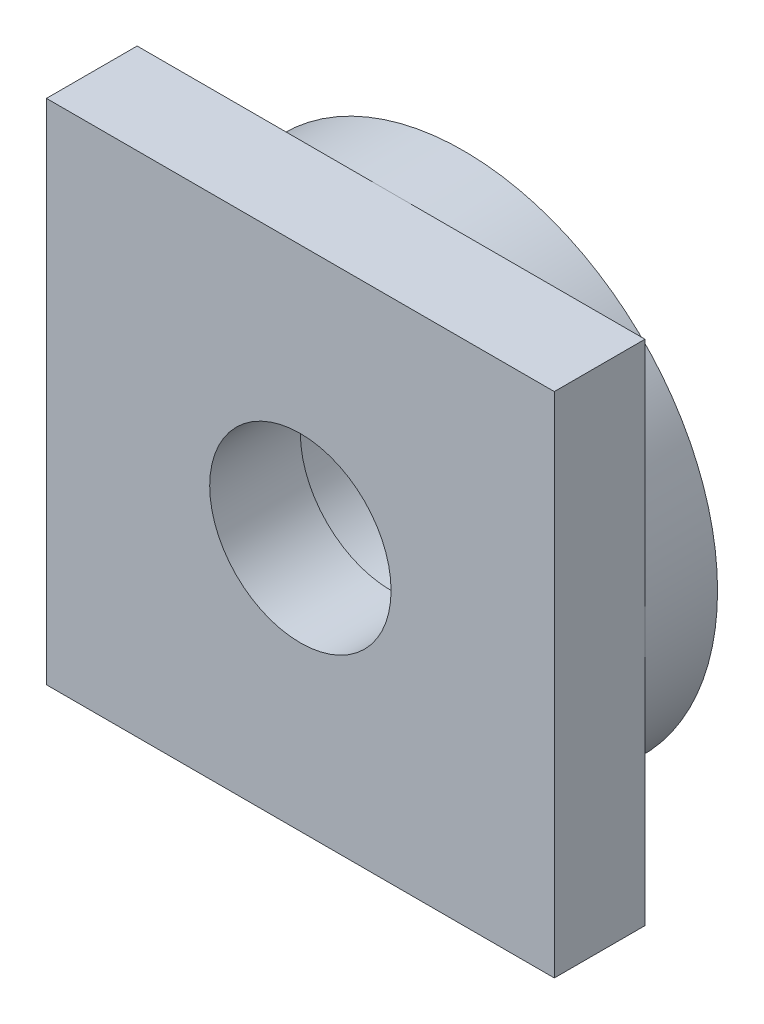
from build123d import *

# Parameters (mm, degrees)
SKETCH1_R           = 28
SKETCH1_R_2         = 18
BOSS_EXTRUDE1_DEPTH = 22
SKETCH2_W           = 56
SKETCH2_H           = 56
BOSS_EXTRUDE2_DEPTH = 10
CUT_EXTRUDE1_DEPTH  = 14
SKETCH4_R           = 5
CUT_EXTRUDE2_DEPTH  = 14
SKETCH5_R           = 21.225012464
SKETCH5_R_2         = 11
BOSS_EXTRUDE3_DEPTH = 8
SKETCH6_R           = 50.391738165
CUT_EXTRUDE3_DEPTH  = 14
SKETCH9_R           = 10
CUT_EXTRUDE6_DEPTH  = 10


with BuildPart() as part:
    # Sketch1 → Boss-Extrude1 (new body)
    with BuildSketch(Plane.XY):
        Circle(SKETCH1_R)
        Circle(SKETCH1_R_2, mode=Mode.SUBTRACT)
    extrude(amount=BOSS_EXTRUDE1_DEPTH)

    # Sketch2 → Boss-Extrude2 (add)
    with BuildSketch(Plane.XY.offset(22)):
        Rectangle(SKETCH2_W, SKETCH2_H)
    extrude(amount=BOSS_EXTRUDE2_DEPTH)

    # Sketch3 → Cut-Extrude1 (cut)
    with BuildSketch(Plane(origin=(0, 0, 0), x_dir=(-1, 0, 0), z_dir=(0, 0, -1))):
        Polygon((0, 0), (-28, -28), (28, -28), align=None)
    extrude(amount=-CUT_EXTRUDE1_DEPTH, mode=Mode.SUBTRACT)

    # Sketch4 → Cut-Extrude2 (cut)
    with BuildSketch(Plane(origin=(0, 0, 22), x_dir=(-1, 0, 0), z_dir=(0, 0, -1))):
        Circle(SKETCH4_R)
    extrude(amount=-CUT_EXTRUDE2_DEPTH, mode=Mode.SUBTRACT)

    # Sketch5 → Boss-Extrude3 (add)
    with BuildSketch(Plane(origin=(0, 0, 22), x_dir=(-1, 0, 0), z_dir=(0, 0, -1))):
        Circle(SKETCH5_R)
        Circle(SKETCH5_R_2, mode=Mode.SUBTRACT)
    extrude(amount=BOSS_EXTRUDE3_DEPTH)

    # Sketch6 → Cut-Extrude3 (cut)
    with BuildSketch(Plane(origin=(0, 0, 0), x_dir=(-1, 0, 0), z_dir=(0, 0, -1))):
        Circle(SKETCH6_R)
    extrude(amount=-CUT_EXTRUDE3_DEPTH, mode=Mode.SUBTRACT)

    # Sketch9 → Cut-Extrude6 (cut)
    with BuildSketch(Plane.XY.offset(32)):
        Circle(SKETCH9_R)
    extrude(amount=-CUT_EXTRUDE6_DEPTH, mode=Mode.SUBTRACT)


solid = part.part
